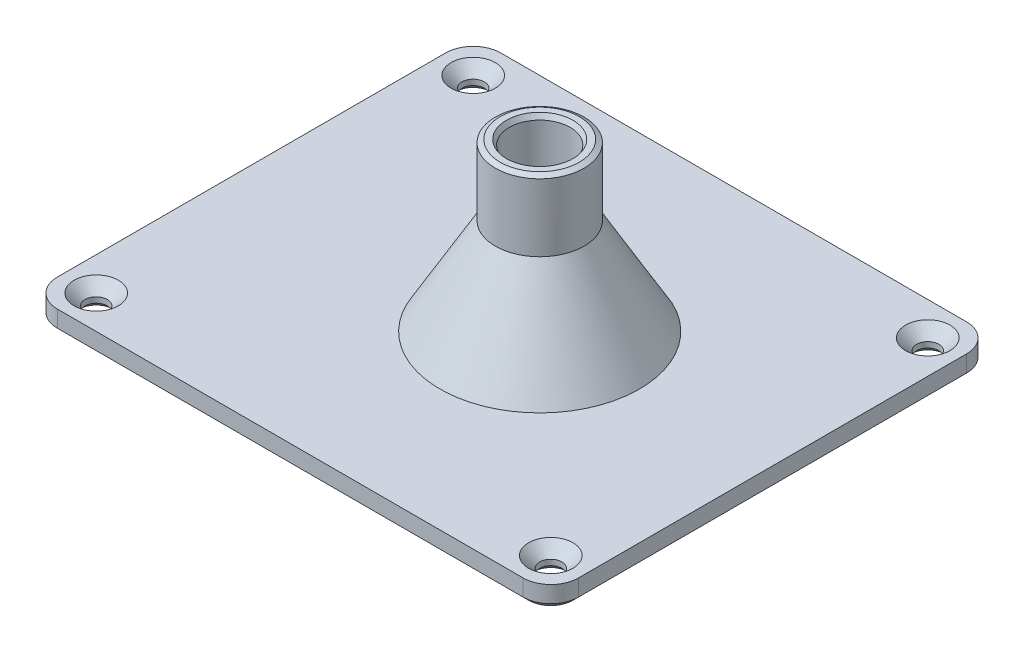
from build123d import *
from OCP.BRepFilletAPI import BRepFilletAPI_MakeChamfer

# Parameters (mm, degrees)
SKETCH_1_W          = 94
SKETCH_1_H          = 80
SKETCH_1_R          = 2
EXTRUDE_1_DEPTH     = 4
FILLET_1_R          = 5
SKETCH_2_R          = 8
EXTRUDE_2_DEPTH     = 30
SKETCH_3_R          = 5.5
CUT_EXTRUDE_1_DEPTH = 71.46275612
CHAMFER_1_SIZE      = 1
CHAMFER_2_SIZE      = 10
CHAMFER_2_SIZE2     = 17.320508076
CHAMFER_3_SIZE      = 2
CHAMFER_4_SIZE      = 0.5
CHAMFER_4_SIZE2     = 0.866025404


with BuildPart() as part:
    # Эскиз1 → Бобышка-Вытянуть1 (new body)
    with BuildSketch(Plane(origin=(0, 0, 0), x_dir=(1, 0, 0), z_dir=(0, 1, 0))):
        Rectangle(SKETCH_1_W, SKETCH_1_H)
        with Locations(Location((41, 34, 0), (0, 0, 270))):
            Circle(SKETCH_1_R, mode=Mode.SUBTRACT)
        with Locations(Location((-41, 34, 0), (0, 0, 90))):
            Circle(SKETCH_1_R, mode=Mode.SUBTRACT)
        with Locations(Location((-41, -34, 0), (0, 0, 270))):
            Circle(SKETCH_1_R, mode=Mode.SUBTRACT)
        with Locations(Location((41, -34, 0), (0, 0, 90))):
            Circle(SKETCH_1_R, mode=Mode.SUBTRACT)
    extrude(amount=EXTRUDE_1_DEPTH)

    # Скругление1
    fillet_1_edges = [part.edges().sort_by_distance(p)[0] for p in [
        (47, 2, 40),
        (-47, 2, 40),
        (-47, 2, -40),
        (47, 2, -40),
    ]]
    fillet(fillet_1_edges, radius=FILLET_1_R)

    # Эскиз2 → Бобышка-Вытянуть2 (add)
    with BuildSketch(Plane(origin=(0, 4, 0), x_dir=(1, 0, 0), z_dir=(0, 1, 0))):
        with Locations(Location((5, 0, 0), (0, 0, 270))):
            Circle(SKETCH_2_R)
    extrude(amount=EXTRUDE_2_DEPTH)

    # Эскиз3 → Вырез-Вытянуть1 (cut, through all)
    with BuildSketch(Plane(origin=(0, 34, 0), x_dir=(1, 0, 0), z_dir=(0, 1, 0))):
        with Locations(Location((5, 0, 0), (0, 0, 270))):
            Circle(SKETCH_3_R)
    extrude(amount=-CUT_EXTRUDE_1_DEPTH, mode=Mode.SUBTRACT)

    # Фаска1
    chamfer_1_edges = [part.edges().sort_by_distance(p)[0] for p in [
        (41, 0, -36),
        (-41, 0, -32),
        (-41, 0, 32),
        (41, 0, 36),
        (0, 0, 40),
        (47, 0, 0),
        (-47, 0, 0),
        (0, 0, -40),
        (45.535533906, 0, 38.535533906),
        (45.535533906, 0, -38.535533906),
        (-45.535533906, 0, -38.535533906),
        (-45.535533906, 0, 38.535533906),
        (5, 0, -5.5),
    ]]
    chamfer(chamfer_1_edges, length=CHAMFER_1_SIZE)

    # Фаска2
    chamfer_2_edges = [part.edges().sort_by_distance(p)[0] for p in [
        (5, 4, -8),
    ]]
    chamfer_2_side = [part.faces().sort_by_distance(p)[0] for p in [
        (0, 4, 38.76565807),
    ]]
    chamfer(chamfer_2_edges, length=CHAMFER_2_SIZE, length2=CHAMFER_2_SIZE2, reference=chamfer_2_side[0])

    # Фаска3
    chamfer_3_edges = [part.edges().sort_by_distance(p)[0] for p in [
        (41, 4, -36),
        (-41, 4, -32),
        (-41, 4, 32),
        (41, 4, 36),
    ]]
    chamfer(chamfer_3_edges, length=CHAMFER_3_SIZE)

    # Фаска4: one chamfer whose edges measure the first distance from different faces: ONE call of the kernel's chamfer builder (chamfer() names one face for all edges)
    chamfer_4_edges_1 = [part.edges().sort_by_distance(p)[0] for p in [
        (5, 34, -8),
    ]]
    chamfer_4_side_1 = [part.faces().sort_by_distance(p)[0] for p in [
        (5, 27.660254038, -8),
    ]]
    chamfer_4_edges_2 = [part.edges().sort_by_distance(p)[0] for p in [
        (5, 34, -5.5),
    ]]
    chamfer_4_side_2 = [part.faces().sort_by_distance(p)[0] for p in [
        (5, 34, -7.77372583),
    ]]
    chamfer_4 = BRepFilletAPI_MakeChamfer(part.part.solid().wrapped)
    for e in chamfer_4_edges_1:
        chamfer_4.Add(CHAMFER_4_SIZE, CHAMFER_4_SIZE2, e.wrapped, chamfer_4_side_1[0].wrapped)  # the first distance lies on this face
    for e in chamfer_4_edges_2:
        chamfer_4.Add(CHAMFER_4_SIZE, CHAMFER_4_SIZE2, e.wrapped, chamfer_4_side_2[0].wrapped)  # the first distance lies on this face
    add(Compound.cast(chamfer_4.Shape()), mode=Mode.REPLACE)


solid = part.part
